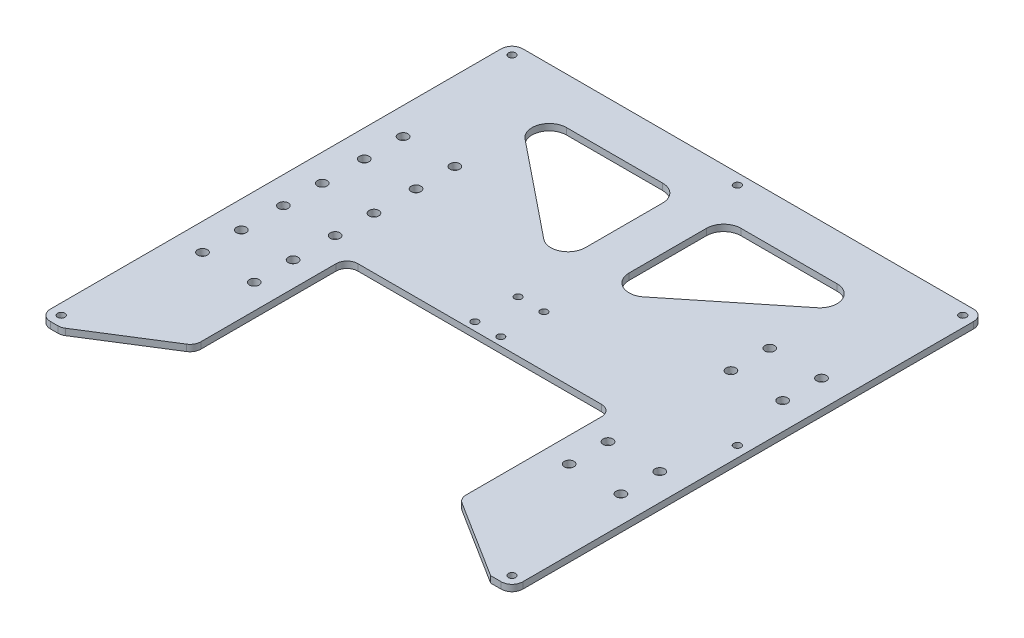
from build123d import *

# Parameters (mm, degrees)
SKETCH1_R           = 1.7
SKETCH1_R_2         = 2.25
SKETCH1_R_3         = 1.65
BOSS_EXTRUDE1_DEPTH = 3
FILLET1_R           = 5


with BuildPart() as part:
    # Sketch1 → Boss-Extrude1 (new body)
    with BuildSketch(Plane(origin=(0, 0, 0), x_dir=(1, 0, 0), z_dir=(0, 1, 0))):
        Polygon((-99.587138739, -109.5), (-61.5, -85.533985256), (-61.5, -15), (61.5, -15), (61.5, -85.533985256), (99.587138739, -109.5), (109.5, -109.5), (109.5, 109.5), (-109.5, 109.5), (-109.5, -109.5), align=None)
        with Locations(Location((-104.5, 104.5, 0), (0, 0, 270))):
            Circle(SKETCH1_R, mode=Mode.SUBTRACT)
        with Locations(Location((104.5, 104.5, 0), (0, 0, 270))):
            Circle(SKETCH1_R, mode=Mode.SUBTRACT)
        with Locations(Location((104.5, -104.5, 0), (0, 0, 90))):
            Circle(SKETCH1_R, mode=Mode.SUBTRACT)
        with Locations(Location((-104.5, -104.5, 0), (0, 0, 90))):
            Circle(SKETCH1_R, mode=Mode.SUBTRACT)
        with Locations(Location((-97, 9, 0), (0, 0, 270))):
            Circle(SKETCH1_R_2, mode=Mode.SUBTRACT)
        with Locations(Location((-73, 9, 0), (0, 0, 270))):
            Circle(SKETCH1_R_2, mode=Mode.SUBTRACT)
        with Locations(Location((-73, -9, 0), (0, 0, 270))):
            Circle(SKETCH1_R_2, mode=Mode.SUBTRACT)
        with Locations(Location((-97, -9, 0), (0, 0, 270))):
            Circle(SKETCH1_R_2, mode=Mode.SUBTRACT)
        with Locations(Location((-97, 46.5, 0), (0, 0, 270))):
            Circle(SKETCH1_R_2, mode=Mode.SUBTRACT)
        with Locations(Location((-73, 46.5, 0), (0, 0, 270))):
            Circle(SKETCH1_R_2, mode=Mode.SUBTRACT)
        with Locations(Location((-73, 28.5, 0), (0, 0, 270))):
            Circle(SKETCH1_R_2, mode=Mode.SUBTRACT)
        with Locations(Location((-97, 28.5, 0), (0, 0, 270))):
            Circle(SKETCH1_R_2, mode=Mode.SUBTRACT)
        with Locations(Location((-97, -28.5, 0), (0, 0, 90))):
            Circle(SKETCH1_R_2, mode=Mode.SUBTRACT)
        with Locations(Location((-73, -28.5, 0), (0, 0, 90))):
            Circle(SKETCH1_R_2, mode=Mode.SUBTRACT)
        with Locations(Location((-73, -46.5, 0), (0, 0, 90))):
            Circle(SKETCH1_R_2, mode=Mode.SUBTRACT)
        with Locations(Location((-97, -46.5, 0), (0, 0, 90))):
            Circle(SKETCH1_R_2, mode=Mode.SUBTRACT)
        with Locations(Location((73, -46.5, 0), (0, 0, 270))):
            Circle(SKETCH1_R_2, mode=Mode.SUBTRACT)
        with Locations(Location((97, -46.5, 0), (0, 0, 270))):
            Circle(SKETCH1_R_2, mode=Mode.SUBTRACT)
        with Locations(Location((73, -28.5, 0), (0, 0, 270))):
            Circle(SKETCH1_R_2, mode=Mode.SUBTRACT)
        with Locations(Location((97, -28.5, 0), (0, 0, 270))):
            Circle(SKETCH1_R_2, mode=Mode.SUBTRACT)
        with Locations(Location((73, 28.5, 0), (0, 0, 90))):
            Circle(SKETCH1_R_2, mode=Mode.SUBTRACT)
        with Locations(Location((97, 28.5, 0), (0, 0, 90))):
            Circle(SKETCH1_R_2, mode=Mode.SUBTRACT)
        with Locations(Location((73, 46.5, 0), (0, 0, 90))):
            Circle(SKETCH1_R_2, mode=Mode.SUBTRACT)
        with Locations(Location((97, 46.5, 0), (0, 0, 90))):
            Circle(SKETCH1_R_2, mode=Mode.SUBTRACT)
        with Locations(Location((0, 104.5, 0), (0, 0, 270))):
            Circle(SKETCH1_R, mode=Mode.SUBTRACT)
        with Locations(Location((104.5, 0, 0), (0, 0, 270))):
            Circle(SKETCH1_R, mode=Mode.SUBTRACT)
        with Locations(Location((-6, 8.81582657, 0), (0, 0, 270))):
            Circle(SKETCH1_R_3, mode=Mode.SUBTRACT)
        with Locations(Location((6, 8.81582657, 0), (0, 0, 270))):
            Circle(SKETCH1_R_3, mode=Mode.SUBTRACT)
        with Locations(Location((6, -11.18417343, 0), (0, 0, 270))):
            Circle(SKETCH1_R_3, mode=Mode.SUBTRACT)
        with Locations(Location((-6, -11.18417343, 0), (0, 0, 270))):
            Circle(SKETCH1_R_3, mode=Mode.SUBTRACT)
        with BuildLine():
            Line((-10.147064808, 80.005570394), (-10.147064808, 44.141462897))
            ThreePointArc((-10.147064808, 44.141462897), (-14.691860424, 36.926093006), (-23.162455474, 37.908818476))
            Line((-23.162455474, 37.908818476), (-67.730913723, 73.772925974))
            ThreePointArc((-67.730913723, 73.772925974), (-70.260758486, 82.664408922), (-62.715523057, 88.005570394))
            Line((-62.715523057, 88.005570394), (-18.147064808, 88.005570394))
            ThreePointArc((-18.147064808, 88.005570394), (-12.490210559, 85.662424644), (-10.147064808, 80.005570394))
        make_face(mode=Mode.SUBTRACT)
        with BuildLine():
            Line((10.147064808, 80.005570394), (10.147064808, 44.141462897))
            ThreePointArc((10.147064808, 44.141462897), (14.691860424, 36.926093006), (23.162455474, 37.908818476))
            Line((23.162455474, 37.908818476), (67.730913723, 73.772925974))
            ThreePointArc((67.730913723, 73.772925974), (70.260758486, 82.664408922), (62.715523057, 88.005570394))
            Line((62.715523057, 88.005570394), (18.147064808, 88.005570394))
            ThreePointArc((18.147064808, 88.005570394), (12.490210559, 85.662424644), (10.147064808, 80.005570394))
        make_face(mode=Mode.SUBTRACT)
    extrude(amount=BOSS_EXTRUDE1_DEPTH)

    # Fillet1
    fillet1_edges = [part.edges().sort_by_distance(p)[0] for p in [
        (109.5, 1.5, 109.5),
        (61.5, 1.5, 85.533985256),
        (61.5, 1.5, 15),
        (-61.5, 1.5, 15),
        (-61.5, 1.5, 85.533985256),
        (-99.587138739, 1.5, 109.5),
        (-109.5, 1.5, 109.5),
        (-109.5, 1.5, -109.5),
        (109.5, 1.5, -109.5),
    ]]
    fillet(fillet1_edges, radius=FILLET1_R)


solid = part.part
